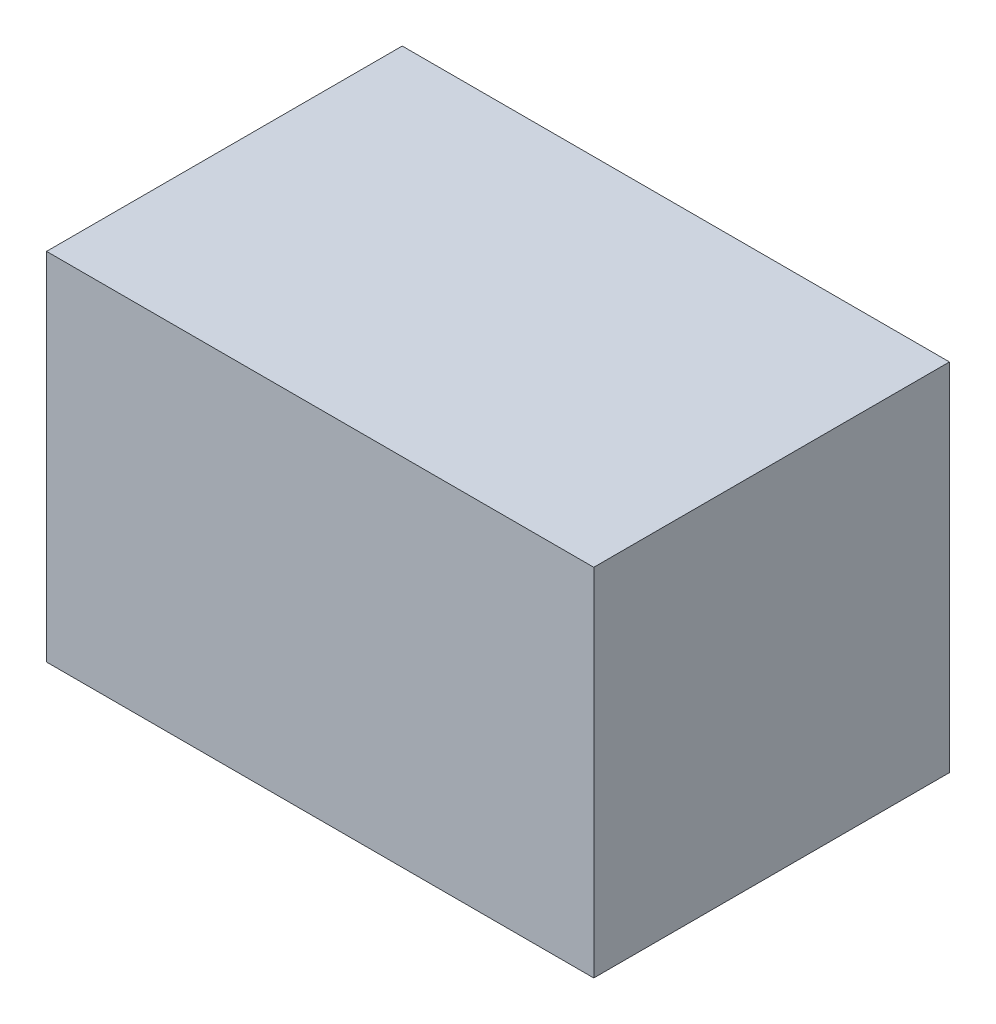
from build123d import *

# Parameters (mm, degrees)
SKETCH1_W           = 200
SKETCH1_H           = 130
BOSS_EXTRUDE1_DEPTH = 130


with BuildPart() as part:
    # Sketch1 → Boss-Extrude1 (new body)
    with BuildSketch(Plane(origin=(0, 0, 0), x_dir=(1, 0, 0), z_dir=(0, 1, 0))):
        Rectangle(SKETCH1_W, SKETCH1_H)
    extrude(amount=BOSS_EXTRUDE1_DEPTH)


solid = part.part
